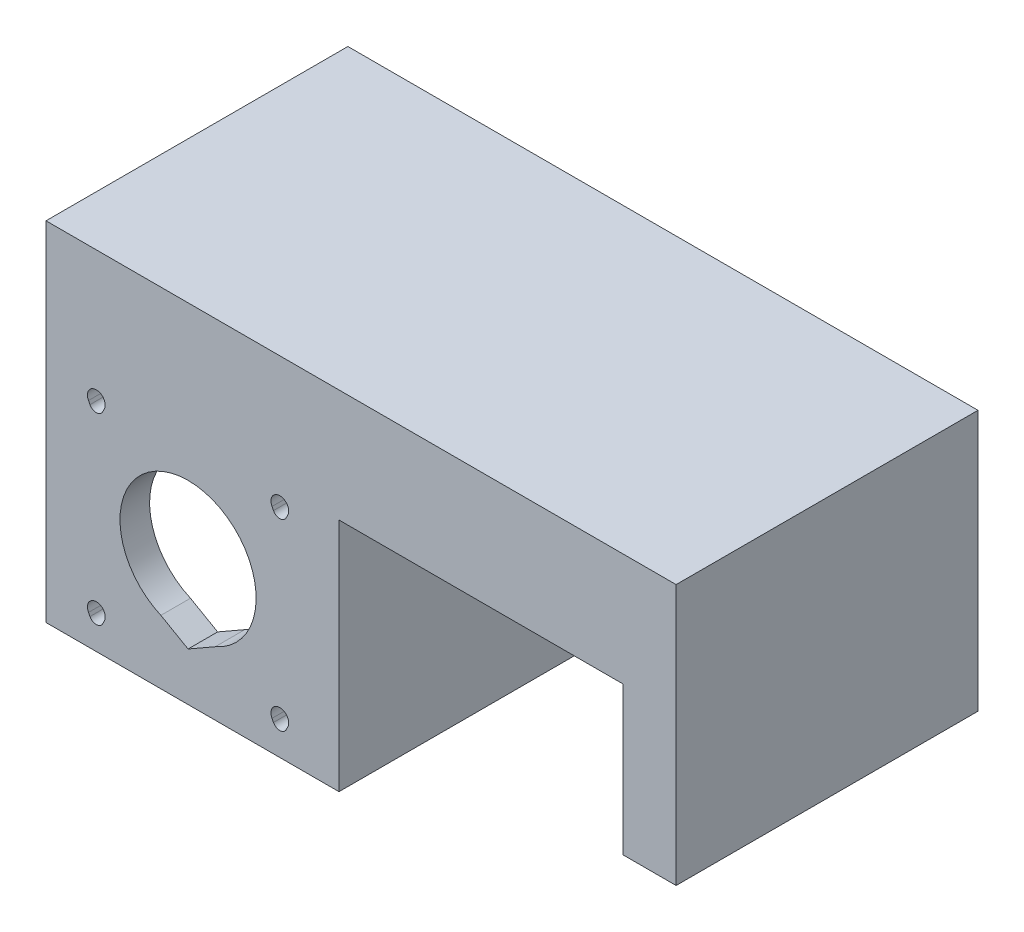
from build123d import *

# Parameters (mm, degrees)
SKETCH1_W            = 48
SKETCH1_H            = 53
BOSS_EXTRUDE1_DEPTH  = 10
SKETCH2_W            = 48
SKETCH2_H            = 5.616325
BOSS_EXTRUDE2_DEPTH  = 33.1917878
SKETCH4_W            = 4
SKETCH4_H            = 10
BOSS_EXTRUDE4_DEPTH  = 40
SKETCH5_W            = 48
SKETCH5_H            = 10.8609375
BOSS_EXTRUDE5_DEPTH  = 23.1917878
SKETCH6_W            = 48
SKETCH6_H            = 5
BOSS_EXTRUDE6_DEPTH  = 42.3
SKETCH7_W            = 12.8082122
SKETCH7_H            = 16.4772625
BOSS_EXTRUDE7_DEPTH  = 48
CUT_EXTRUDE1_REACH   = 84.426
SKETCH8_R            = 11.5
SKETCH8_R_2          = 1.5
FILLET1_R            = 10
FILLET2_R            = 4
SKETCH9_W            = 5
SKETCH9_H            = 16.4772625
BOSS_EXTRUDE9_DEPTH  = 48
CUT_EXTRUDE2_DEPTH   = 88.252507127
SKETCH11_W           = 51
SKETCH11_H           = 16.4772625
BOSS_EXTRUDE10_DEPTH = 49.45
BOSS_EXTRUDE11_DEPTH = 46
SKETCH16_W           = 47.95
SKETCH16_H           = 51
BOSS_EXTRUDE14_DEPTH = 2.55
SKETCH14_W           = 5
SKETCH14_H           = 42.3
BOSS_EXTRUDE13_DEPTH = 1.5
SKETCH17_W           = 51
SKETCH17_H           = 19.0272625
BOSS_EXTRUDE15_DEPTH = 9
BOSS_EXTRUDE16_DEPTH = 25
SKETCH19_R           = 1.9304
CUT_EXTRUDE3_DEPTH   = 125.404890183
CUT_EXTRUDE4_REACH   = 129.391


with BuildPart() as part:
    # Sketch1 → Boss-Extrude1 (new body)
    with BuildSketch(Plane.XY):
        with Locations((24, 26.5)):
            Rectangle(SKETCH1_W, SKETCH1_H)
    extrude(amount=BOSS_EXTRUDE1_DEPTH)

    # Sketch2 → Boss-Extrude2 (add)
    with BuildSketch(Plane(origin=(0, 0, 0), x_dir=(-1, 0, 0), z_dir=(0, 0, -1))):
        with Locations((-24, -2.8081625)):
            Rectangle(SKETCH2_W, SKETCH2_H)
    extrude(amount=-BOSS_EXTRUDE2_DEPTH)

    # Sketch4 → Boss-Extrude4 (add)
    with BuildSketch(Plane.XY.offset(10)):
        with Locations((2, 48)):
            Rectangle(SKETCH4_W, SKETCH4_H)
        with Locations((46, 48)):
            Rectangle(SKETCH4_W, SKETCH4_H)
    extrude(amount=BOSS_EXTRUDE4_DEPTH)

    # Sketch5 → Boss-Extrude5 (add)
    with BuildSketch(Plane.XY.offset(10)):
        with Locations((24, 5.43046875)):
            Rectangle(SKETCH5_W, SKETCH5_H)
    extrude(amount=BOSS_EXTRUDE5_DEPTH)

    # Sketch6 → Boss-Extrude6 (add)
    with BuildSketch(Plane.XZ.offset(5.616325)):
        with Locations((24, 30.6917878)):
            Rectangle(SKETCH6_W, SKETCH6_H)
    extrude(amount=BOSS_EXTRUDE6_DEPTH)

    # Sketch7 → Boss-Extrude7 (add)
    with BuildSketch(Plane.ZY):
        with Locations((-6.4041061, 2.62230625)):
            Rectangle(SKETCH7_W, SKETCH7_H)
    extrude(amount=-BOSS_EXTRUDE7_DEPTH)

    # Sketch8 → Cut-Extrude1 (cut, up to next)
    with BuildSketch(Plane(origin=(0, 0, 28.1917878), x_dir=(-1, 0, 0), z_dir=(0, 0, -1)), mode=Mode.PRIVATE) as cut_extrude1_sk1:
        with Locations((-24, -26.616325)):
            Circle(SKETCH8_R)
    cut_extrude1_tool1 = extrude(cut_extrude1_sk1.sketch, amount=-CUT_EXTRUDE1_REACH, mode=Mode.PRIVATE) & part.part
    # Sketch8 → Cut-Extrude1 (cut, up to next)
    with BuildSketch(Plane(origin=(0, 0, 28.1917878), x_dir=(-1, 0, 0), z_dir=(0, 0, -1)), mode=Mode.PRIVATE) as cut_extrude1_sk2:
        with Locations((-39.5, -11.116325)):
            Circle(SKETCH8_R_2)
    cut_extrude1_tool2 = extrude(cut_extrude1_sk2.sketch, amount=-CUT_EXTRUDE1_REACH, mode=Mode.PRIVATE) & part.part
    # Sketch8 → Cut-Extrude1 (cut, up to next)
    with BuildSketch(Plane(origin=(0, 0, 28.1917878), x_dir=(-1, 0, 0), z_dir=(0, 0, -1)), mode=Mode.PRIVATE) as cut_extrude1_sk3:
        with Locations((-39.5, -42.116325)):
            Circle(SKETCH8_R_2)
    cut_extrude1_tool3 = extrude(cut_extrude1_sk3.sketch, amount=-CUT_EXTRUDE1_REACH, mode=Mode.PRIVATE) & part.part
    # Sketch8 → Cut-Extrude1 (cut, up to next)
    with BuildSketch(Plane(origin=(0, 0, 28.1917878), x_dir=(-1, 0, 0), z_dir=(0, 0, -1)), mode=Mode.PRIVATE) as cut_extrude1_sk4:
        with Locations((-8.5, -11.116325)):
            Circle(SKETCH8_R_2)
    cut_extrude1_tool4 = extrude(cut_extrude1_sk4.sketch, amount=-CUT_EXTRUDE1_REACH, mode=Mode.PRIVATE) & part.part
    # Sketch8 → Cut-Extrude1 (cut, up to next)
    with BuildSketch(Plane(origin=(0, 0, 28.1917878), x_dir=(-1, 0, 0), z_dir=(0, 0, -1)), mode=Mode.PRIVATE) as cut_extrude1_sk5:
        with Locations((-8.5, -42.116325)):
            Circle(SKETCH8_R_2)
    cut_extrude1_tool5 = extrude(cut_extrude1_sk5.sketch, amount=-CUT_EXTRUDE1_REACH, mode=Mode.PRIVATE) & part.part
    add(cut_extrude1_tool1.solids().sort_by_distance((24, -26.616325, 28.191788))[0], mode=Mode.SUBTRACT)
    add(cut_extrude1_tool2.solids().sort_by_distance((39.5, -11.116325, 28.191788))[0], mode=Mode.SUBTRACT)
    add(cut_extrude1_tool3.solids().sort_by_distance((39.5, -42.116325, 28.191788))[0], mode=Mode.SUBTRACT)
    add(cut_extrude1_tool4.solids().sort_by_distance((8.5, -11.116325, 28.191788))[0], mode=Mode.SUBTRACT)
    add(cut_extrude1_tool5.solids().sort_by_distance((8.5, -42.116325, 28.191788))[0], mode=Mode.SUBTRACT)

    # Fillet1
    fillet1_edges = [part.edges().sort_by_distance(p)[0] for p in [
        (24, 10.8609375, 0),
    ]]
    fillet(fillet1_edges, radius=FILLET1_R)

    # Fillet2
    fillet2_edges = [part.edges().sort_by_distance(p)[0] for p in [
        (2, 43, 10),
        (46, 43, 10),
    ]]
    fillet(fillet2_edges, radius=FILLET2_R)

    # Sketch9 → Boss-Extrude9 (add)
    with BuildSketch(Plane(origin=(48, 0, 0), x_dir=(0, 0, -1), z_dir=(1, 0, 0))):
        with Locations((15.3082122, 2.62230625)):
            Rectangle(SKETCH9_W, SKETCH9_H)
    extrude(amount=-BOSS_EXTRUDE9_DEPTH)

    # Sketch10 → Cut-Extrude2 (cut, through all)
    with BuildSketch(Plane(origin=(48, 0, 0), x_dir=(0, 0, -1), z_dir=(1, 0, 0))):
        Polygon((17.8082122, 10.8609375), (-33.1917878, 10.8609375), (-76.887145623, 43.902095521), (-50.794096938, 74.436514195), (27.207463492, 71.105486703), align=None)
    extrude(amount=-CUT_EXTRUDE2_DEPTH, mode=Mode.SUBTRACT)

    # Sketch11 → Boss-Extrude10 (add)
    with BuildSketch(Plane(origin=(48, 0, 0), x_dir=(0, 0, -1), z_dir=(1, 0, 0))):
        with Locations((-7.6917878, 2.62230625)):
            Rectangle(SKETCH11_W, SKETCH11_H)
    extrude(amount=BOSS_EXTRUDE10_DEPTH)

    # Sketch12 → Boss-Extrude11 (add)
    with BuildSketch(Plane(origin=(0, 0, 28.1917878), x_dir=(-1, 0, 0), z_dir=(0, 0, -1))):
        Polygon((-48, -47.916325), (-45, -47.916325), (-45, -5.616325), (-49.5, -5.616325), (-49.5, -47.916325), align=None)
    extrude(amount=BOSS_EXTRUDE11_DEPTH)

    # Sketch16 → Boss-Extrude14 (add)
    with BuildSketch(Plane.XZ.offset(5.616325)):
        with Locations((73.475, 7.6917878)):
            Rectangle(SKETCH16_W, SKETCH16_H)
    extrude(amount=BOSS_EXTRUDE14_DEPTH)

    # Sketch14 → Boss-Extrude13 (add)
    with BuildSketch(Plane(origin=(49.5, 0, 0), x_dir=(0, 0, -1), z_dir=(1, 0, 0))):
        with Locations((-30.6917878, -26.766325)):
            Rectangle(SKETCH14_W, SKETCH14_H)
    extrude(amount=-BOSS_EXTRUDE13_DEPTH)

    # Sketch17 → Boss-Extrude15 (add)
    with BuildSketch(Plane(origin=(97.45, 0, 0), x_dir=(0, 0, -1), z_dir=(1, 0, 0))):
        with Locations((-7.6917878, 1.34730625)):
            Rectangle(SKETCH17_W, SKETCH17_H)
    extrude(amount=BOSS_EXTRUDE15_DEPTH)

    # Sketch18 → Boss-Extrude16 (add)
    with BuildSketch(Plane.XZ.offset(8.166325)):
        Polygon((49.5, -17.8082122), (106.45, -17.8082122), (106.45, -9.8082122), (106.45, 33.1917878), (97.45, 33.1917878), (97.45, -9.8082122), (49.5, -9.8082122), align=None)
    extrude(amount=BOSS_EXTRUDE16_DEPTH)

    # Sketch19 → Cut-Extrude3 (cut, through all)
    with BuildSketch(Plane.XY.offset(-9.8082122)):
        with Locations((58.475, -26.166325)):
            Circle(SKETCH19_R)
        with Locations((88.475, -26.166325)):
            Circle(SKETCH19_R)
    extrude(amount=-CUT_EXTRUDE3_DEPTH, mode=Mode.SUBTRACT)

    # Sketch20 → Cut-Extrude4 (cut, up to next)
    with BuildSketch(Plane.XY.offset(33.1917878), mode=Mode.PRIVATE) as cut_extrude4_sk1:
        with BuildLine():
            Line((7.184805756, -11.837618352), (7.433777419, -12.319738309))
            ThreePointArc((7.433777419, -12.319738309), (8.5, -12.969130092), (9.566222581, -12.319738309))
            Line((9.566222581, -12.319738309), (9.815194244, -11.837618352))
            ThreePointArc((9.815194244, -11.837618352), (8.5, -12.616325), (7.184805756, -11.837618352))
        make_face()
    cut_extrude4_tool1 = extrude(cut_extrude4_sk1.sketch, amount=-CUT_EXTRUDE4_REACH, mode=Mode.PRIVATE) & part.part
    # Sketch20 → Cut-Extrude4 (cut, up to next)
    with BuildSketch(Plane.XY.offset(33.1917878), mode=Mode.PRIVATE) as cut_extrude4_sk2:
        with BuildLine():
            Line((7.184805756, -42.837618352), (7.433777419, -43.319738309))
            ThreePointArc((7.433777419, -43.319738309), (8.5, -43.969130092), (9.566222581, -43.319738309))
            Line((9.566222581, -43.319738309), (9.815194244, -42.837618352))
            ThreePointArc((9.815194244, -42.837618352), (8.5, -43.616325), (7.184805756, -42.837618352))
        make_face()
    cut_extrude4_tool2 = extrude(cut_extrude4_sk2.sketch, amount=-CUT_EXTRUDE4_REACH, mode=Mode.PRIVATE) & part.part
    # Sketch20 → Cut-Extrude4 (cut, up to next)
    with BuildSketch(Plane.XY.offset(33.1917878), mode=Mode.PRIVATE) as cut_extrude4_sk3:
        with BuildLine():
            Line((38.184805756, -42.837618352), (38.433777419, -43.319738309))
            ThreePointArc((38.433777419, -43.319738309), (39.5, -43.969130092), (40.566222581, -43.319738309))
            Line((40.566222581, -43.319738309), (40.815194244, -42.837618352))
            ThreePointArc((40.815194244, -42.837618352), (39.5, -43.616325), (38.184805756, -42.837618352))
        make_face()
    cut_extrude4_tool3 = extrude(cut_extrude4_sk3.sketch, amount=-CUT_EXTRUDE4_REACH, mode=Mode.PRIVATE) & part.part
    # Sketch20 → Cut-Extrude4 (cut, up to next)
    with BuildSketch(Plane.XY.offset(33.1917878), mode=Mode.PRIVATE) as cut_extrude4_sk4:
        with BuildLine():
            Line((38.184805756, -11.837618352), (38.433777419, -12.319738309))
            ThreePointArc((38.433777419, -12.319738309), (39.5, -12.969130092), (40.566222581, -12.319738309))
            Line((40.566222581, -12.319738309), (40.815194244, -11.837618352))
            ThreePointArc((40.815194244, -11.837618352), (39.5, -12.616325), (38.184805756, -11.837618352))
        make_face()
    cut_extrude4_tool4 = extrude(cut_extrude4_sk4.sketch, amount=-CUT_EXTRUDE4_REACH, mode=Mode.PRIVATE) & part.part
    # Sketch20 → Cut-Extrude4 (cut, up to next)
    with BuildSketch(Plane.XY.offset(33.1917878), mode=Mode.PRIVATE) as cut_extrude4_sk5:
        with BuildLine():
            Line((19.405287598, -37.158555217), (24, -39.787183437))
            Line((24, -39.787183437), (28.594712402, -37.158555217))
            ThreePointArc((28.594712402, -37.158555217), (24, -38.116325), (19.405287598, -37.158555217))
        make_face()
    cut_extrude4_tool5 = extrude(cut_extrude4_sk5.sketch, amount=-CUT_EXTRUDE4_REACH, mode=Mode.PRIVATE) & part.part
    add(cut_extrude4_tool1.solids().sort_by_distance((8.5, -12.63481, 33.191788))[0], mode=Mode.SUBTRACT)
    add(cut_extrude4_tool2.solids().sort_by_distance((8.5, -43.63481, 33.191788))[0], mode=Mode.SUBTRACT)
    add(cut_extrude4_tool3.solids().sort_by_distance((39.5, -43.63481, 33.191788))[0], mode=Mode.SUBTRACT)
    add(cut_extrude4_tool4.solids().sort_by_distance((39.5, -12.63481, 33.191788))[0], mode=Mode.SUBTRACT)
    add(cut_extrude4_tool5.solids().sort_by_distance((24, -38.507203, 33.191788))[0], mode=Mode.SUBTRACT)


solid = part.part
